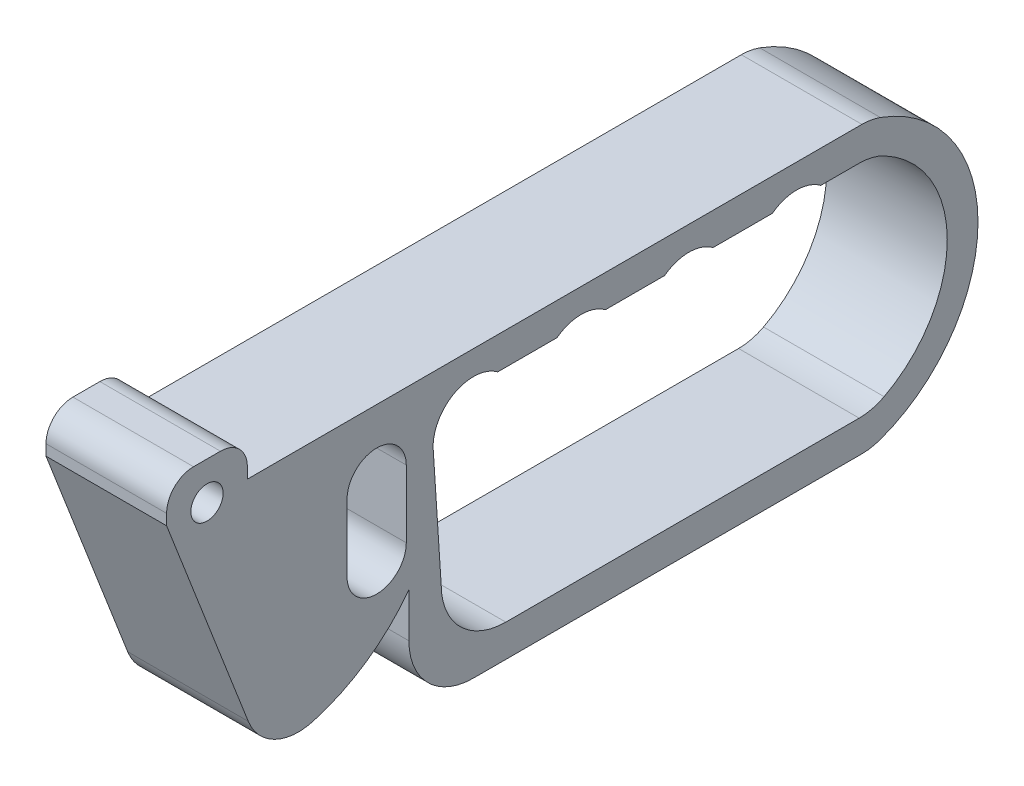
from build123d import *

# Parameters (mm, degrees)
BOSS_EXTRUDE1_DEPTH      = 11.2
BOSS_EXTRUDE1_DEPTH_BACK = 11.2
CUT_EXTRUDE1_START       = -11.2
SKETCH3_R                = 7.5
CUT_EXTRUDE1_DEPTH       = 22.4
FILLET1_R                = 10
CUT_EXTRUDE2_START       = -11.2
CUT_EXTRUDE2_DEPTH       = 22.4
FILLET2_R                = 10
BOSS_EXTRUDE2_START      = -11.2
BOSS_EXTRUDE2_DEPTH      = 22.4
FILLET3_R                = 10
CUT_EXTRUDE3_START       = -11.2
CUT_EXTRUDE3_DEPTH       = 22.4
CUT_EXTRUDE4_START       = -11.2
SKETCH7_R                = 3
CUT_EXTRUDE4_DEPTH       = 22.4


with BuildPart() as part:
    # Sketch2 → Boss-Extrude1 (new, two sides: drawn at the far end of the back side and taken through both)
    with BuildSketch(Plane(origin=(0, 0, 0), x_dir=(0, 0, -1), z_dir=(1, 0, 0)).offset(-BOSS_EXTRUDE1_DEPTH_BACK)):
        with BuildLine():
            Line((-52.85, 26.5), (32.85, 26.5))
            ThreePointArc((32.85, 26.5), (52.85, 0), (32.85, -26.5))
            Line((32.85, -26.5), (-40.85, -26.5))
            ThreePointArc((-40.85, -26.5), (-49.335281374, -22.985281374), (-52.85, -14.5))
            Line((-52.85, -14.5), (-52.85, 26.5))
        make_face()
        with BuildLine():
            Line((32.85, 20.5), (-40.85, 20.5))
            ThreePointArc((-40.85, 20.5), (-45.092640687, 18.742640687), (-46.85, 14.5))
            Line((-46.85, 14.5), (-46.85, -8.5))
            ThreePointArc((-46.85, -8.5), (-43.335281374, -16.985281374), (-34.85, -20.5))
            Line((-34.85, -20.5), (32.85, -20.5))
            ThreePointArc((32.85, -20.5), (47.142020276, 0), (32.85, 20.5))
        make_face(mode=Mode.SUBTRACT)
    extrude(amount=BOSS_EXTRUDE1_DEPTH + BOSS_EXTRUDE1_DEPTH_BACK)

    # Sketch3 → Cut-Extrude1 (cut)
    with BuildSketch(Plane(origin=(0, 0, 0), x_dir=(0, 0, -1), z_dir=(1, 0, 0)).offset(CUT_EXTRUDE1_START)):
        with Locations((-40.85, 14.5)):
            Circle(SKETCH3_R)
        with Locations((-20.85, 14.5)):
            Circle(SKETCH3_R)
        with Locations((-0.85, 14.5)):
            Circle(SKETCH3_R)
        with Locations((19.15, 14.5)):
            Circle(SKETCH3_R)
    extrude(amount=CUT_EXTRUDE1_DEPTH, mode=Mode.SUBTRACT)

    # Fillet1
    fillet1_edges = [part.edges().sort_by_distance(p)[0] for p in [
        (0, 20.5, -32.85),
    ]]
    fillet(fillet1_edges, radius=FILLET1_R)

    # Sketch4 → Cut-Extrude2 (cut)
    with BuildSketch(Plane(origin=(0, 0, 0), x_dir=(0, 0, -1), z_dir=(1, 0, 0)).offset(CUT_EXTRUDE2_START)):
        Polygon((-46.85, -8.5), (-48.333754922, 14.006631719), (-46.85, 14.006631719), align=None)
    extrude(amount=CUT_EXTRUDE2_DEPTH, mode=Mode.SUBTRACT)

    # Fillet2
    fillet2_edges = [part.edges().sort_by_distance(p)[0] for p in [
        (0, -20.5, -32.85),
        (0, 26.5, -32.85),
        (0, -26.5, -32.85),
    ]]
    fillet(fillet2_edges, radius=FILLET2_R)

    # Sketch5 → Boss-Extrude2 (add)
    with BuildSketch(Plane(origin=(0, 0, 0), x_dir=(0, 0, -1), z_dir=(1, 0, 0)).offset(BOSS_EXTRUDE2_START)):
        with BuildLine():
            Line((-52.85, -6.3), (-52.85, 26.5))
            Line((-52.85, 26.5), (-82.85, 26.5))
            Line((-82.85, 26.5), (-82.85, 28.5))
            ThreePointArc((-82.85, 28.5), (-84.314466094, 32.035533906), (-87.85, 33.5))
            Line((-87.85, 33.5), (-92.85, 33.5))
            ThreePointArc((-92.85, 33.5), (-96.385533906, 32.035533906), (-97.85, 28.5))
            Line((-97.85, 28.5), (-97.85, 26.5))
            Line((-97.85, 26.5), (-79.85, -19.82922762))
            ThreePointArc((-79.85, -19.82922762), (-64.75, -16.257700748), (-52.85, -6.3))
        make_face()
    extrude(amount=BOSS_EXTRUDE2_DEPTH)

    # Fillet3
    fillet3_edges = [part.edges().sort_by_distance(p)[0] for p in [
        (0, -19.82922762, 79.85),
    ]]
    fillet(fillet3_edges, radius=FILLET3_R)

    # Sketch6 → Cut-Extrude3 (cut)
    with BuildSketch(Plane(origin=(0, 0, 0), x_dir=(0, 0, -1), z_dir=(1, 0, 0)).offset(CUT_EXTRUDE3_START)):
        with BuildLine():
            Line((-53.333754922, 14.006631719), (-53.333754922, 1.506631719))
            ThreePointArc((-53.333754922, 1.506631719), (-58.833754922, -3.993368281), (-64.333754922, 1.506631719))
            Line((-64.333754922, 1.506631719), (-64.333754922, 14.006631719))
            ThreePointArc((-64.333754922, 14.006631719), (-58.833754922, 19.506631719), (-53.333754922, 14.006631719))
        make_face()
    extrude(amount=CUT_EXTRUDE3_DEPTH, mode=Mode.SUBTRACT)

    # Sketch7 → Cut-Extrude4 (cut)
    with BuildSketch(Plane(origin=(0, 0, 0), x_dir=(0, 0, -1), z_dir=(1, 0, 0)).offset(CUT_EXTRUDE4_START)):
        with Locations((-90.35, 26.5)):
            Circle(SKETCH7_R)
    extrude(amount=CUT_EXTRUDE4_DEPTH, mode=Mode.SUBTRACT)


solid = part.part
